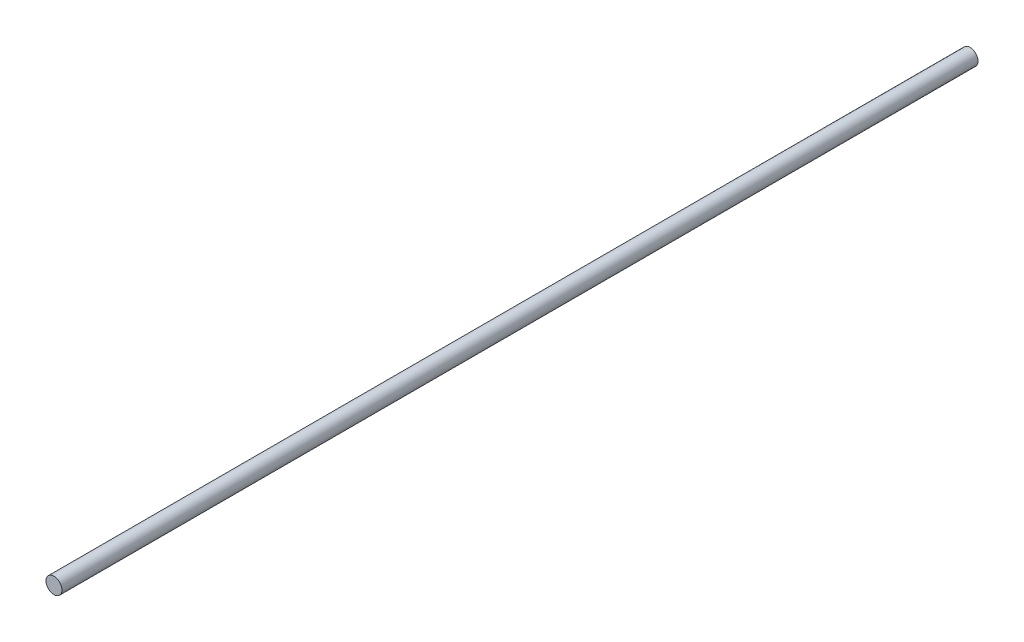
from build123d import *

# Parameters (mm, degrees)
SKETCH1_R           = 3.5
BOSS_EXTRUDE1_DEPTH = 401


with BuildPart() as part:
    # Sketch1 → Boss-Extrude1 (new body)
    with BuildSketch(Plane.XY):
        Circle(SKETCH1_R)
    extrude(amount=-BOSS_EXTRUDE1_DEPTH)


solid = part.part
